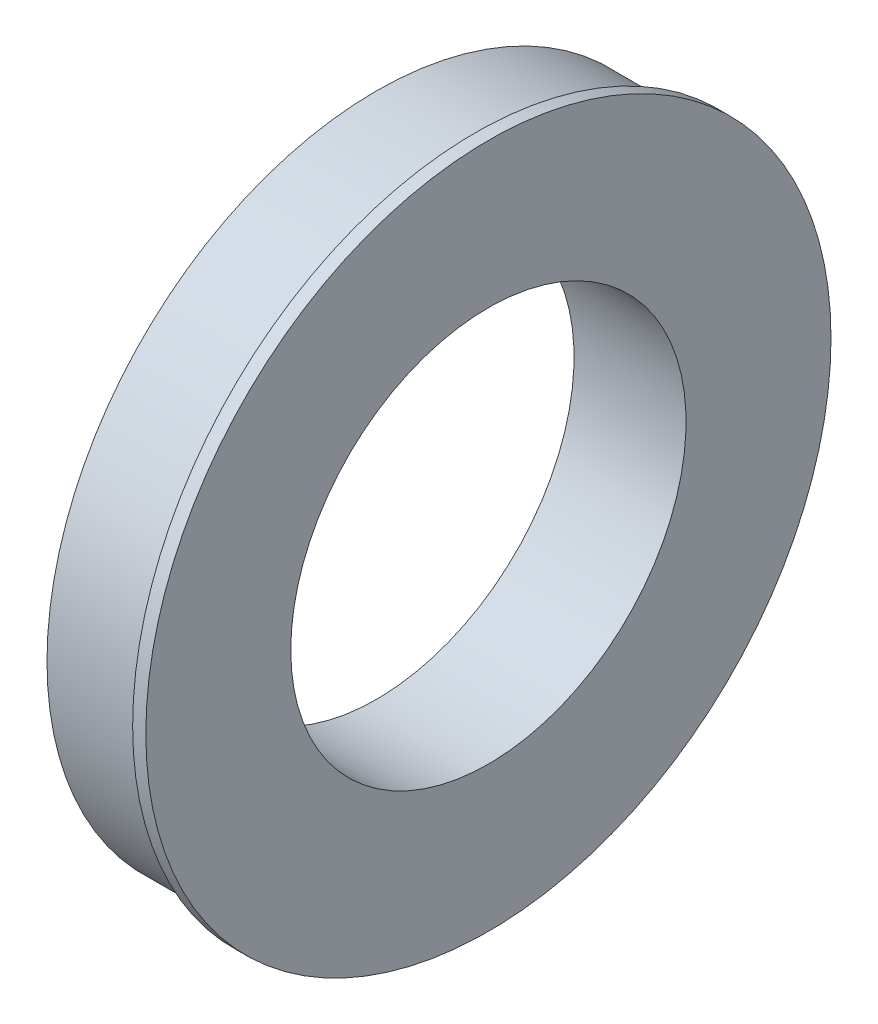
from build123d import *

# Parameters (mm, degrees)
SKETCH2_R           = 63.5
SKETCH2_R_2         = 38.1
BOSS_EXTRUDE1_DEPTH = 19.05
SKETCH3_R           = 66.04
SKETCH3_R_2         = 38.1
BOSS_EXTRUDE2_DEPTH = 2.54


with BuildPart() as part:
    # Sketch2 → Boss-Extrude1 (new body)
    with BuildSketch(Plane(origin=(0, 0, 0), x_dir=(0, 0, -1), z_dir=(1, 0, 0))):
        with Locations(Location((0, 0, 0), (0, 0, 180))):
            Circle(SKETCH2_R)
        with Locations(Location((0, 0, 0), (0, 0, 180))):
            Circle(SKETCH2_R_2, mode=Mode.SUBTRACT)
    extrude(amount=BOSS_EXTRUDE1_DEPTH)

    # Sketch3 → Boss-Extrude2 (add)
    with BuildSketch(Plane(origin=(19.05, 0, 0), x_dir=(0, 0, -1), z_dir=(1, 0, 0))):
        Circle(SKETCH3_R)
        with Locations(Location((0, 0, 0), (0, 0, 180))):
            Circle(SKETCH3_R_2, mode=Mode.SUBTRACT)
    extrude(amount=BOSS_EXTRUDE2_DEPTH)


solid = part.part
